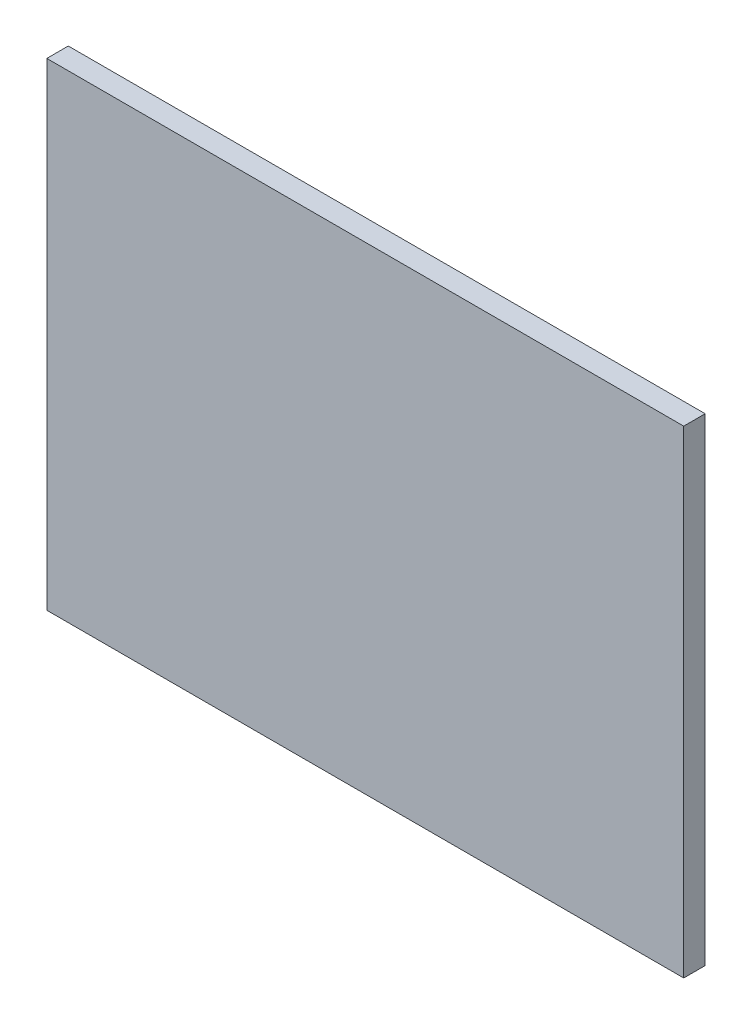
from build123d import *

# Parameters (mm, degrees)
SKETCH3_W           = 296.550595169
SKETCH3_H           = 222.52485262
BOSS_EXTRUDE1_DEPTH = 10


with BuildPart() as part:
    # Sketch3 → Boss-Extrude1 (new body)
    with BuildSketch(Plane.XY):
        with Locations((148.275297585, 111.26242631)):
            Rectangle(SKETCH3_W, SKETCH3_H)
    extrude(amount=BOSS_EXTRUDE1_DEPTH)


solid = part.part
